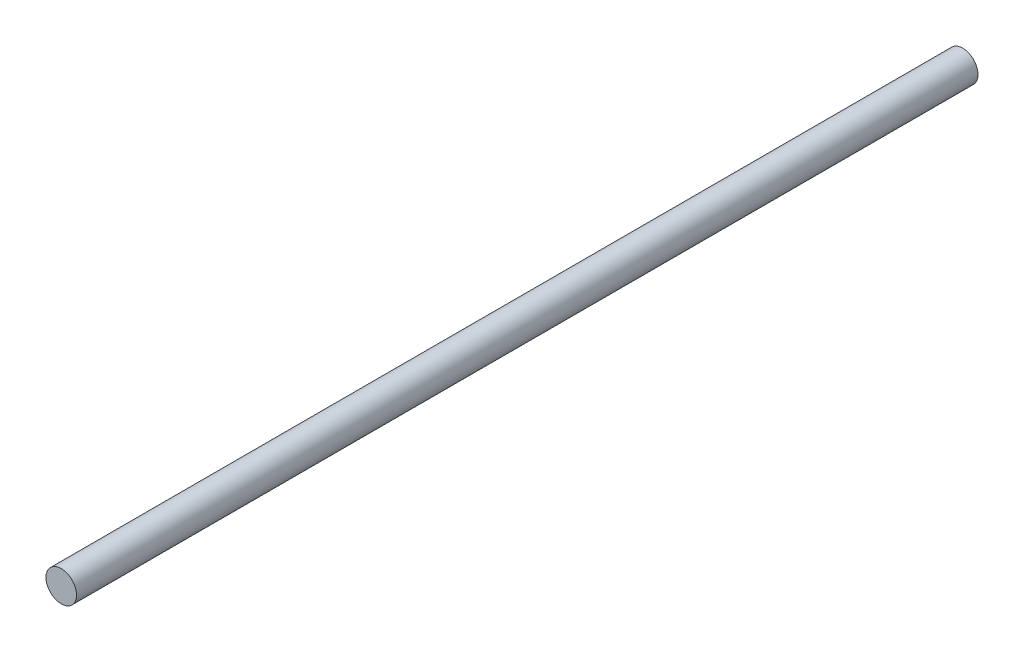
from build123d import *

# Parameters (mm, degrees)
BOSS_EXTRUDE1_DEPTH      = 25
BOSS_EXTRUDE1_DEPTH_BACK = 270
SKETCH1_R                = 5


with BuildPart() as part:
    # Sketch1 → Boss-Extrude1 (new, two sides: drawn at the far end of the back side and taken through both)
    with BuildSketch(Plane.XY.offset(-BOSS_EXTRUDE1_DEPTH_BACK)):
        with Locations((11.5, -184.674624292)):
            Circle(SKETCH1_R)
    extrude(amount=BOSS_EXTRUDE1_DEPTH + BOSS_EXTRUDE1_DEPTH_BACK)


solid = part.part
